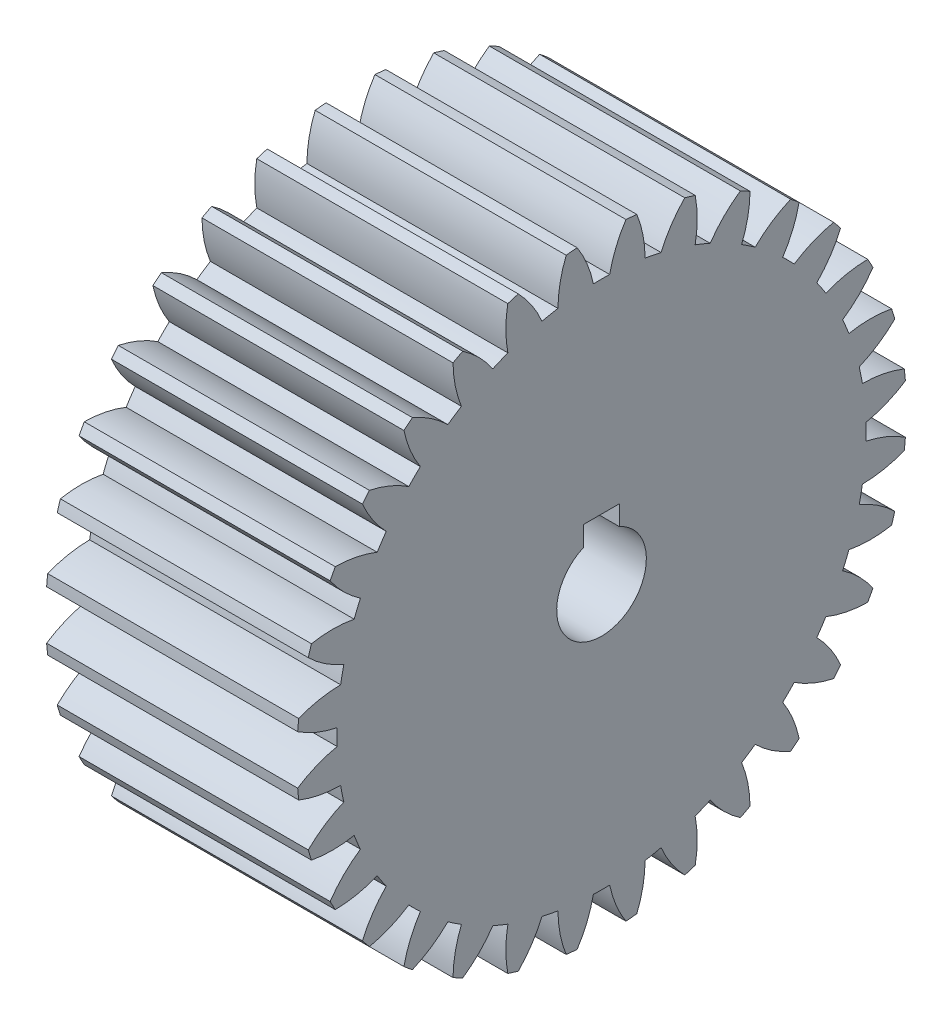
from build123d import *

# Parameters (mm, degrees)
BASPROSKE_W     = 28
BASPROSKE_H     = 34
TOOTHCUT_DEPTH  = 56.641710973
TEETHCUTS_COUNT = 32
TEETHCUTS_ANGLE = 348.75
BORSKE_R        = 5
BORE_DEPTH      = 50.0000508
KEYSKE_W        = 4
KEYSKE_H        = 6.8
KEYWAY_DEPTH    = 50.0000508


with BuildPart() as part:
    # BasProSke → Base-Revolve (revolve)
    with BuildSketch(Plane(origin=(0, 0, 0), x_dir=(1, 0, 0), z_dir=(0, 1, 0)), mode=Mode.PRIVATE) as base_revolve_sk:
        with Locations((14, 17)):
            Rectangle(BASPROSKE_W, BASPROSKE_H)
    revolve(base_revolve_sk.sketch.rotate(Axis((-10, 0, 0), (1, 0, 0)), 180), axis=Axis((-10, 0, 0), (1, 0, 0)))

    # TooCutSke → ToothCut (cut, through all)
    with BuildSketch(Plane(origin=(0, 0, 0), x_dir=(0, 0, -1), z_dir=(1, 0, 0))):
        with BuildLine():
            ThreePointArc((0.90975268, 29.484968222), (0, 29.499), (-0.90975268, 29.484968222))
            ThreePointArc((-0.90975268, 29.484968222), (-1.616072745, 31.786377155), (-2.740819811, 33.914830855))
            ThreePointArc((-2.740819811, 33.914830855), (0, 34.0254), (2.740819811, 33.914830855))
            ThreePointArc((2.740819811, 33.914830855), (1.616072745, 31.786377155), (0.90975268, 29.484968222))
        make_face()
    toothcut = extrude(amount=TOOTHCUT_DEPTH, mode=Mode.SUBTRACT)

    # TeethCuts: ToothCut ×32 about axis
    teethcuts_axis = Axis((-10, 0, 0), (1, 0, 0))
    for i in range(1, TEETHCUTS_COUNT):
        add(toothcut.rotate(teethcuts_axis, i * TEETHCUTS_ANGLE / (TEETHCUTS_COUNT - 1)), mode=Mode.SUBTRACT)

    # BorSke → Bore (cut, symmetric)
    with BuildSketch(Plane(origin=(0, 0, 0), x_dir=(0, 0, -1), z_dir=(1, 0, 0))):
        with Locations(Location((0, 0, 0), (0, 0, 180))):
            Circle(BORSKE_R)
    extrude(amount=BORE_DEPTH, both=True, mode=Mode.SUBTRACT)

    # KeySke → Keyway (cut, symmetric)
    with BuildSketch(Plane(origin=(0, 0, 0), x_dir=(0, 0, -1), z_dir=(1, 0, 0))):
        with Locations((0, 3.4)):
            Rectangle(KEYSKE_W, KEYSKE_H)
    extrude(amount=KEYWAY_DEPTH, both=True, mode=Mode.SUBTRACT)


solid = part.part
